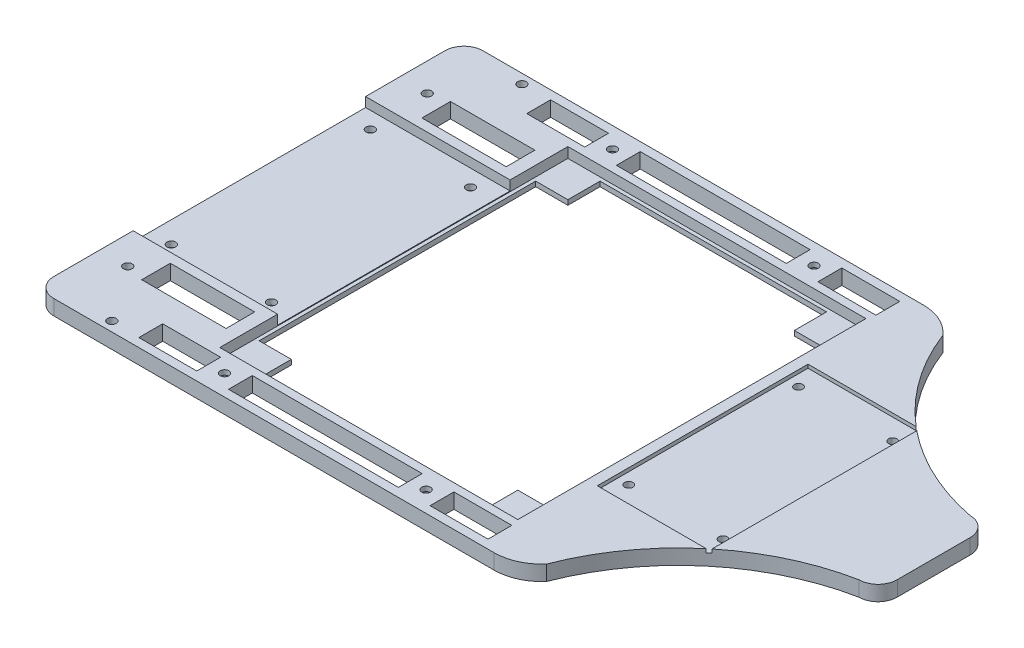
from build123d import *

# Parameters (mm, degrees)
SALIENTE_EXTRUIR1_DEPTH = 6.35
CROQUIS2_R              = 1.825
CROQUIS2_W              = 63.849825594
CROQUIS2_H              = 10
CROQUIS2_W_2            = 24.299825594
CORTAR_EXTRUIR1_DEPTH   = 220.409920137
CROQUIS4_W              = 45
CROQUIS4_H              = 84.1
CORTAR_EXTRUIR3_DEPTH   = 1.5
CROQUIS5_R              = 1.75
CORTAR_EXTRUIR4_DEPTH   = 220.371632292
CROQUIS7_W              = 45
CROQUIS7_H              = 2.275
CORTAR_EXTRUIR5_DEPTH   = 1.5
CROQUIS9_W              = 125
CROQUIS9_H              = 146
CORTAR_EXTRUIR7_DEPTH   = 4.3
CROQUIS10_R             = 2.8
CORTAR_EXTRUIR8_DEPTH   = 4.35
CORTAR_EXTRUIR12_DEPTH  = 220.409920137
CORTAR_EXTRUIR15_DEPTH  = 1.5
CROQUIS19_W             = 7.395174406
CROQUIS19_H             = 10
CORTAR_EXTRUIR16_DEPTH  = 220.409920137
CROQUIS20_W             = 60.600000004
CROQUIS20_H             = 97.5
CORTAR_EXTRUIR17_DEPTH  = 4
CROQUIS21_R             = 1.825
CORTAR_EXTRUIR18_DEPTH  = 220.354486059
CROQUIS25_W             = 35.4
CROQUIS25_H             = 12
CORTAR_EXTRUIR21_DEPTH  = 220.409920137
CORTAR_EXTRUIR22_DEPTH  = 220.36016173
CROQUIS28_R             = 1.825
CORTAR_EXTRUIR24_DEPTH  = 220.409920137


with BuildPart() as part:
    # Croquis1 → Saliente-Extruir1 (new body)
    with BuildSketch(Plane(origin=(0, 0, 0), x_dir=(1, 0, 0), z_dir=(0, 1, 0))):
        with BuildLine():
            Line((0, 0), (200, 0))
            Line((200, 0), (200, 15.2))
            ThreePointArc((200, 15.2), (197.701163079, 20.938172036), (191.9990235, 23.3249845))
            ThreePointArc((191.9990235, 23.3249845), (148.666739026, 44.032184001), (120.7781513, 83.1307986))
            ThreePointArc((120.7781513, 83.1307986), (113.982057966, 88.196272982), (105.7, 90))
            Line((105.7, 90), (0, 90))
            Line((0, 90), (-79, 90))
            ThreePointArc((-79, 90), (-84.638146896, 87.675499941), (-86.999825594, 82.052824894))
            Line((-86.999825594, 82.052824894), (-86.999825594, 41.494023494))
            ThreePointArc((-86.999825594, 41.494023494), (-92.052704294, 29.329564667), (-102.353503833, 21.119864881))
            ThreePointArc((-102.353503833, 21.119864881), (-108.040391417, 18.79326931), (-110.4, 13.12))
            Line((-110.4, 13.12), (-110.4, 0))
            Line((-110.4, 0), (0, 0))
        make_face()
    extrude(amount=SALIENTE_EXTRUIR1_DEPTH)

    # Simetría2: part across plane


with BuildPart() as part_1:
    add(part.part)
    add(part.part.mirror(Plane(origin=(0, 6.35, 0), x_dir=(1, 0, 0), z_dir=(0, 0, -1))))

    # Croquis2 → Cortar-Extruir1 (cut, through all)
    with BuildSketch(Plane(origin=(0, 6.35, 0), x_dir=(1, 0, 0), z_dir=(0, 1, 0))):
        with Locations(Location((68.5, 81.35, 0), (0, 0, 270))):
            Circle(CROQUIS2_R)
        with Locations(Location((-16.05, 81.35, 0), (0, 0, 270))):
            Circle(CROQUIS2_R)
        with Locations(Location((68.5, -81.35, 0), (0, 0, 90))):
            Circle(CROQUIS2_R)
        with Locations(Location((-16.05, -81.35, 0), (0, 0, 90))):
            Circle(CROQUIS2_R)
        with Locations((29.925087203, -81.35)):
            Rectangle(CROQUIS2_W, CROQUIS2_H)
        with Locations((-34.849912797, -81.35)):
            Rectangle(CROQUIS2_W_2, CROQUIS2_H)
        with Locations((87.299912797, -81.35)):
            Rectangle(CROQUIS2_W_2, CROQUIS2_H)
        with Locations((-34.849912797, 81.35)):
            Rectangle(CROQUIS2_W_2, CROQUIS2_H)
        with Locations((29.925087203, 81.35)):
            Rectangle(CROQUIS2_W, CROQUIS2_H)
        with Locations((87.299912797, 81.35)):
            Rectangle(CROQUIS2_W_2, CROQUIS2_H)
    extrude(amount=-CORTAR_EXTRUIR1_DEPTH, mode=Mode.SUBTRACT)

    # Croquis4 → Cortar-Extruir3 (cut)
    with BuildSketch(Plane(origin=(0, 6.35, 0), x_dir=(1, 0, 0), z_dir=(0, 1, 0))):
        with Locations((127.5, 0)):
            Rectangle(CROQUIS4_W, CROQUIS4_H)
    extrude(amount=-CORTAR_EXTRUIR3_DEPTH, mode=Mode.SUBTRACT)

    # Croquis5 → Cortar-Extruir4 (cut, through all)
    with BuildSketch(Plane(origin=(0, 4.85, 0), x_dir=(1, 0, 0), z_dir=(0, 1, 0))):
        with Locations(Location((147.25, 35.6, 0), (0, 0, 270))):
            Circle(CROQUIS5_R)
        with Locations(Location((107.75, 35.6, 0), (0, 0, 90))):
            Circle(CROQUIS5_R)
        with Locations(Location((147.25, -35.6, 0), (0, 0, 90))):
            Circle(CROQUIS5_R)
        with Locations(Location((107.75, -35.6, 0), (0, 0, 270))):
            Circle(CROQUIS5_R)
    extrude(amount=-CORTAR_EXTRUIR4_DEPTH, mode=Mode.SUBTRACT)

    # Croquis7 → Cortar-Extruir5 (cut)
    with BuildSketch(Plane(origin=(0, 6.35, 0), x_dir=(1, 0, 0), z_dir=(0, 1, 0))):
        with Locations((127.5, 43.1875)):
            Rectangle(CROQUIS7_W, CROQUIS7_H)
    extrude(amount=-CORTAR_EXTRUIR5_DEPTH, mode=Mode.SUBTRACT)

    # Croquis9 → Cortar-Extruir7 (cut)
    with BuildSketch(Plane(origin=(0, 6.35, 0), x_dir=(1, 0, 0), z_dir=(0, 1, 0))):
        with Locations((36.10017441, 0)):
            Rectangle(CROQUIS9_W, CROQUIS9_H)
    extrude(amount=-CORTAR_EXTRUIR7_DEPTH, mode=Mode.SUBTRACT)

    # Croquis10 → Cortar-Extruir8 (cut)
    with BuildSketch(Plane.XZ):
        with Locations(Location((-16.05, 81.35, 0), (0, 0, 270))):
            Circle(CROQUIS10_R)
        with Locations(Location((-16.05, -81.35, 0), (0, 0, 90))):
            Circle(CROQUIS10_R)
        with Locations(Location((68.5, -81.35, 0), (0, 0, 270))):
            Circle(CROQUIS10_R)
        with Locations(Location((68.5, 81.35, 0), (0, 0, 90))):
            Circle(CROQUIS10_R)
    extrude(amount=-CORTAR_EXTRUIR8_DEPTH, mode=Mode.SUBTRACT)

    # Croquis16 → Cortar-Extruir12 (cut, through all)
    with BuildSketch(Plane(origin=(0, 6.35, 0), x_dir=(1, 0, 0), z_dir=(0, 1, 0))):
        Polygon((-86.999825594, 41.494023494), (-110.4, 41.494023494), (-110.4, 13.12), (-110.4, -13.12), (-110.4, -41.494023494), (-86.999825594, -41.494023494), align=None)
    extrude(amount=-CORTAR_EXTRUIR12_DEPTH, mode=Mode.SUBTRACT)

    # Croquis18 → Cortar-Extruir15 (cut)
    with BuildSketch(Plane(origin=(0, 6.35, 0), x_dir=(1, 0, 0), z_dir=(0, 1, 0))):
        Polygon((105, 44.325), (103, 44.325), (103, -44.05), (150, -44.05), (150, -42.05), (105, -42.05), align=None)
    extrude(amount=-CORTAR_EXTRUIR15_DEPTH, mode=Mode.SUBTRACT)

    # Croquis19 → Cortar-Extruir16 (cut, through all)
    with BuildSketch(Plane(origin=(0, 6.35, 0), x_dir=(1, 0, 0), z_dir=(0, 1, 0))):
        with Locations((-5.697412797, 81.35)):
            Rectangle(CROQUIS19_W, CROQUIS19_H)
        with Locations((-5.697412797, -81.35)):
            Rectangle(CROQUIS19_W, CROQUIS19_H)
    extrude(amount=-CORTAR_EXTRUIR16_DEPTH, mode=Mode.SUBTRACT)

    # Croquis20 → Cortar-Extruir17 (cut)
    with BuildSketch(Plane(origin=(0, 6.35, 0), x_dir=(1, 0, 0), z_dir=(0, 1, 0))):
        with Locations((-56.699825592, 0)):
            Rectangle(CROQUIS20_W, CROQUIS20_H)
    extrude(amount=-CORTAR_EXTRUIR17_DEPTH, mode=Mode.SUBTRACT)

    # Croquis21 → Cortar-Extruir18 (cut, through all)
    with BuildSketch(Plane(origin=(0, 2.35, 0), x_dir=(1, 0, 0), z_dir=(0, 1, 0))):
        with Locations(Location((-77.999825594, 41.75, 0), (0, 0, 270))):
            Circle(CROQUIS21_R)
        with Locations(Location((-35.999825594, 41.75, 0), (0, 0, 270))):
            Circle(CROQUIS21_R)
        with Locations(Location((-35.999825594, -41.75, 0), (0, 0, 270))):
            Circle(CROQUIS21_R)
        with Locations(Location((-77.999825594, -41.75, 0), (0, 0, 270))):
            Circle(CROQUIS21_R)
    extrude(amount=-CORTAR_EXTRUIR18_DEPTH, mode=Mode.SUBTRACT)

    # Croquis25 → Cortar-Extruir21 (cut, through all)
    with BuildSketch(Plane.XZ):
        with Locations((-49.699825594, 58.76)):
            Rectangle(CROQUIS25_W, CROQUIS25_H)
        with Locations((-49.699825594, -58.76)):
            Rectangle(CROQUIS25_W, CROQUIS25_H)
    extrude(amount=-CORTAR_EXTRUIR21_DEPTH, mode=Mode.SUBTRACT)

    # Croquis26 → Cortar-Extruir22 (cut, through all)
    with BuildSketch(Plane(origin=(0, 2.05, 0), x_dir=(1, 0, 0), z_dir=(0, 1, 0))):
        Polygon((-11.39982559, 71.5), (-11.39982559, 58), (-24.89982559, 58), (-24.89982559, -58), (-11.39982559, -58), (-11.39982559, -71.5), (83.60017441, -71.5), (83.60017441, -58), (97.10017441, -58), (97.10017441, 58), (83.60017441, 58), (83.60017441, 71.5), align=None)
    extrude(amount=-CORTAR_EXTRUIR22_DEPTH, mode=Mode.SUBTRACT)

    # Croquis28 → Cortar-Extruir24 (cut, through all)
    with BuildSketch(Plane(origin=(0, 6.35, 0), x_dir=(1, 0, 0), z_dir=(0, 1, 0))):
        with Locations(Location((-75.199825594, -62.81, 0), (0, 0, 270))):
            Circle(CROQUIS28_R)
        with Locations(Location((-58.699825594, -86, 0), (0, 0, 270))):
            Circle(CROQUIS28_R)
        with Locations(Location((-75.199825594, 62.81, 0), (0, 0, 90))):
            Circle(CROQUIS28_R)
        with Locations(Location((-58.699825594, 86, 0), (0, 0, 90))):
            Circle(CROQUIS28_R)
    extrude(amount=-CORTAR_EXTRUIR24_DEPTH, mode=Mode.SUBTRACT)


solid = part_1.part
